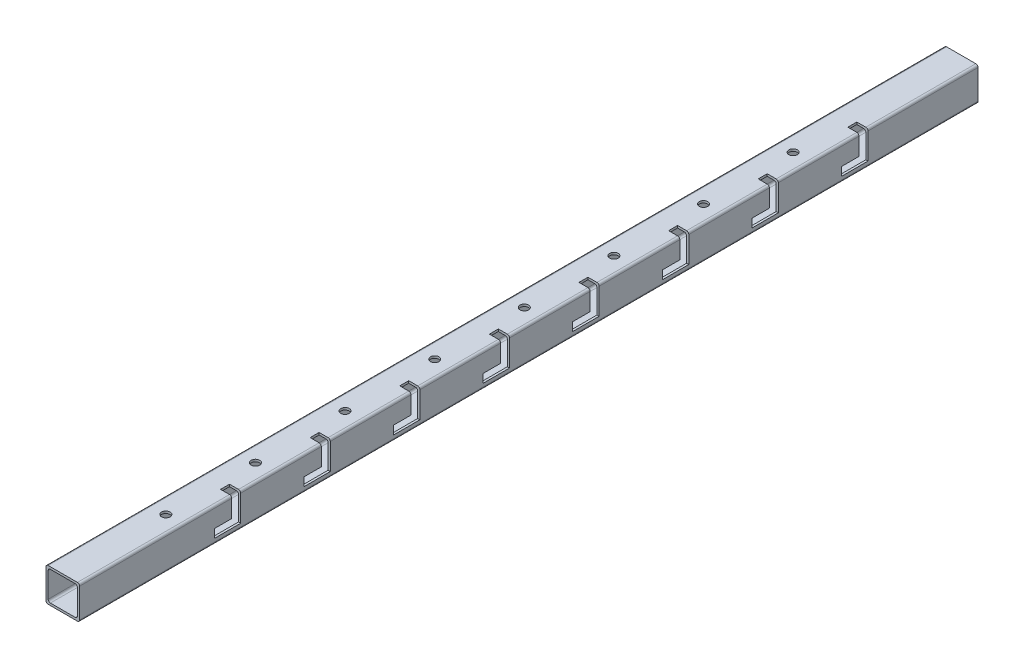
from build123d import *

# Parameters (mm, degrees)
SKETCH3_W           = 19.05
SKETCH3_H           = 19.05
SKETCH3_W_2         = 16.5608
SKETCH3_H_2         = 16.5608
BOSS_EXTRUDE1_DEPTH = 254.635
FILLET1_R           = 1.2446
CUT_EXTRUDE1_REACH  = 257.524
SKETCH4_R           = 2.413
CUT_EXTRUDE3_START  = -19.05
CUT_EXTRUDE3_DEPTH  = 6.35
LPATTERN2_COUNT     = 8
LPATTERN2_PITCH     = 50.8


with BuildPart() as part:
    # Sketch3 → Boss-Extrude1 (new, symmetric)
    with BuildSketch(Plane.XY):
        Rectangle(SKETCH3_W, SKETCH3_H)
        Rectangle(SKETCH3_W_2, SKETCH3_H_2, mode=Mode.SUBTRACT)
    extrude(amount=BOSS_EXTRUDE1_DEPTH, both=True)

    # Fillet1
    fillet1_edges = [part.edges().sort_by_distance(p)[0] for p in [
        (-8.2804, -8.2804, 0),
        (8.2804, -8.2804, 0),
        (8.2804, 8.2804, 0),
        (-8.2804, 8.2804, 0),
        (9.525, -9.525, 0),
        (-9.525, -9.525, 0),
        (-9.525, 9.525, 0),
        (9.525, 9.525, 0),
    ]]
    fillet(fillet1_edges, radius=FILLET1_R)

    # Sketch4 → Cut-Extrude1 (cut, up to next)
    with BuildSketch(Plane(origin=(0, 9.525, 0), x_dir=(1, 0, 0), z_dir=(0, 1, 0)), mode=Mode.PRIVATE) as cut_extrude1_sk1:
        with Locations(Location((0, 159.385, 0), (0, 0, 270))):
            Circle(SKETCH4_R)
    cut_extrude1_tool1 = extrude(cut_extrude1_sk1.sketch, amount=-CUT_EXTRUDE1_REACH, mode=Mode.PRIVATE) & part.part
    # Sketch4 → Cut-Extrude1 (cut, up to next)
    with BuildSketch(Plane(origin=(0, 9.525, 0), x_dir=(1, 0, 0), z_dir=(0, 1, 0)), mode=Mode.PRIVATE) as cut_extrude1_sk2:
        with Locations(Location((0, 108.585, 0), (0, 0, 270))):
            Circle(SKETCH4_R)
    cut_extrude1_tool2 = extrude(cut_extrude1_sk2.sketch, amount=-CUT_EXTRUDE1_REACH, mode=Mode.PRIVATE) & part.part
    # Sketch4 → Cut-Extrude1 (cut, up to next)
    with BuildSketch(Plane(origin=(0, 9.525, 0), x_dir=(1, 0, 0), z_dir=(0, 1, 0)), mode=Mode.PRIVATE) as cut_extrude1_sk3:
        with Locations(Location((0, 57.785, 0), (0, 0, 270))):
            Circle(SKETCH4_R)
    cut_extrude1_tool3 = extrude(cut_extrude1_sk3.sketch, amount=-CUT_EXTRUDE1_REACH, mode=Mode.PRIVATE) & part.part
    # Sketch4 → Cut-Extrude1 (cut, up to next)
    with BuildSketch(Plane(origin=(0, 9.525, 0), x_dir=(1, 0, 0), z_dir=(0, 1, 0)), mode=Mode.PRIVATE) as cut_extrude1_sk4:
        with Locations(Location((0, 6.985, 0), (0, 0, 270))):
            Circle(SKETCH4_R)
    cut_extrude1_tool4 = extrude(cut_extrude1_sk4.sketch, amount=-CUT_EXTRUDE1_REACH, mode=Mode.PRIVATE) & part.part
    # Sketch4 → Cut-Extrude1 (cut, up to next)
    with BuildSketch(Plane(origin=(0, 9.525, 0), x_dir=(1, 0, 0), z_dir=(0, 1, 0)), mode=Mode.PRIVATE) as cut_extrude1_sk5:
        with Locations(Location((0, -43.815, 0), (0, 0, 270))):
            Circle(SKETCH4_R)
    cut_extrude1_tool5 = extrude(cut_extrude1_sk5.sketch, amount=-CUT_EXTRUDE1_REACH, mode=Mode.PRIVATE) & part.part
    # Sketch4 → Cut-Extrude1 (cut, up to next)
    with BuildSketch(Plane(origin=(0, 9.525, 0), x_dir=(1, 0, 0), z_dir=(0, 1, 0)), mode=Mode.PRIVATE) as cut_extrude1_sk6:
        with Locations(Location((0, -94.615, 0), (0, 0, 270))):
            Circle(SKETCH4_R)
    cut_extrude1_tool6 = extrude(cut_extrude1_sk6.sketch, amount=-CUT_EXTRUDE1_REACH, mode=Mode.PRIVATE) & part.part
    # Sketch4 → Cut-Extrude1 (cut, up to next)
    with BuildSketch(Plane(origin=(0, 9.525, 0), x_dir=(1, 0, 0), z_dir=(0, 1, 0)), mode=Mode.PRIVATE) as cut_extrude1_sk7:
        with Locations(Location((0, -145.415, 0), (0, 0, 270))):
            Circle(SKETCH4_R)
    cut_extrude1_tool7 = extrude(cut_extrude1_sk7.sketch, amount=-CUT_EXTRUDE1_REACH, mode=Mode.PRIVATE) & part.part
    # Sketch4 → Cut-Extrude1 (cut, up to next)
    with BuildSketch(Plane(origin=(0, 9.525, 0), x_dir=(1, 0, 0), z_dir=(0, 1, 0)), mode=Mode.PRIVATE) as cut_extrude1_sk8:
        with Locations(Location((0, -196.215, 0), (0, 0, 270))):
            Circle(SKETCH4_R)
    cut_extrude1_tool8 = extrude(cut_extrude1_sk8.sketch, amount=-CUT_EXTRUDE1_REACH, mode=Mode.PRIVATE) & part.part
    add(cut_extrude1_tool1.solids().sort_by_distance((0, 9.525, -159.385))[0], mode=Mode.SUBTRACT)
    add(cut_extrude1_tool2.solids().sort_by_distance((0, 9.525, -108.585))[0], mode=Mode.SUBTRACT)
    add(cut_extrude1_tool3.solids().sort_by_distance((0, 9.525, -57.785))[0], mode=Mode.SUBTRACT)
    add(cut_extrude1_tool4.solids().sort_by_distance((0, 9.525, -6.985))[0], mode=Mode.SUBTRACT)
    add(cut_extrude1_tool5.solids().sort_by_distance((0, 9.525, 43.815))[0], mode=Mode.SUBTRACT)
    add(cut_extrude1_tool6.solids().sort_by_distance((0, 9.525, 94.615))[0], mode=Mode.SUBTRACT)
    add(cut_extrude1_tool7.solids().sort_by_distance((0, 9.525, 145.415))[0], mode=Mode.SUBTRACT)
    add(cut_extrude1_tool8.solids().sort_by_distance((0, 9.525, 196.215))[0], mode=Mode.SUBTRACT)

    # Sketch6 → Cut-Extrude3 (cut)
    with BuildSketch(Plane.ZY.offset(9.525).offset(CUT_EXTRUDE3_START)):
        Polygon((-182.118, -1.651), (-187.198, -1.651), (-187.198, 9.525), (-192.278, 9.525), (-192.278, -6.477), (-182.118, -6.477), (-177.292, -6.477), (-177.292, -1.651), align=None)
    cut_extrude3 = extrude(amount=CUT_EXTRUDE3_DEPTH, mode=Mode.SUBTRACT)

    # LPattern2: Cut-Extrude3 ×8
    with Locations(*[(0, 0, i * LPATTERN2_PITCH) for i in range(1, LPATTERN2_COUNT)]):
        add(cut_extrude3, mode=Mode.SUBTRACT)


solid = part.part
